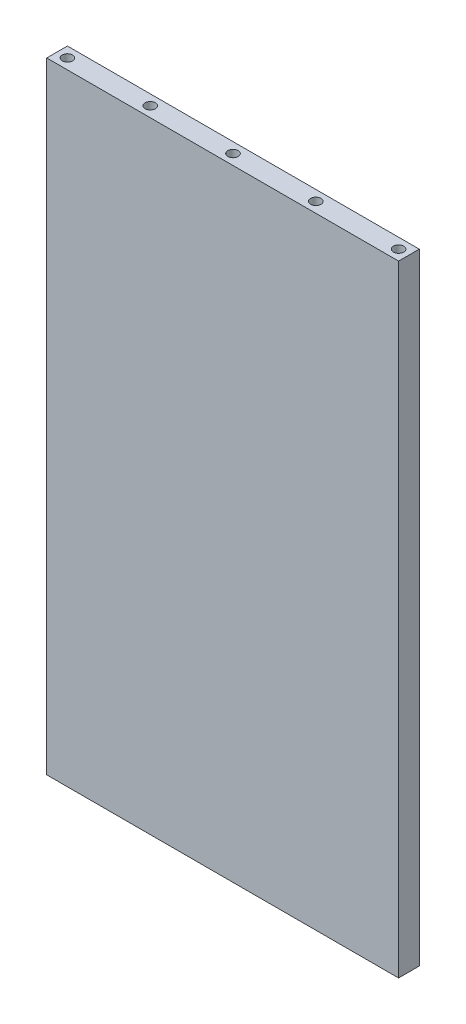
from build123d import *

# Parameters (mm, degrees)
CROQUIS1_W              = 170
CROQUIS1_H              = 300
SALIENTE_EXTRUIR1_DEPTH = 5
CROQUIS3_R              = 2.5
CORTAR_EXTRUIR2_DEPTH   = 5
CROQUIS4_R              = 2.5
CORTAR_EXTRUIR3_DEPTH   = 5


with BuildPart() as part:
    # Croquis1 → Saliente-Extruir1 (new, symmetric)
    with BuildSketch(Plane.XY):
        Rectangle(CROQUIS1_W, CROQUIS1_H)
    extrude(amount=SALIENTE_EXTRUIR1_DEPTH, both=True)

    # Croquis3 → Cortar-Extruir2 (cut)
    with BuildSketch(Plane.XZ.offset(150)):
        with Locations(Location((80, 0, 0), (0, 0, 270))):
            Circle(CROQUIS3_R)
        with Locations(Location((40, 0, 0), (0, 0, 270))):
            Circle(CROQUIS3_R)
        with Locations(Location((0, 0, 0), (0, 0, 270))):
            Circle(CROQUIS3_R)
        with Locations(Location((-40, 0, 0), (0, 0, 270))):
            Circle(CROQUIS3_R)
        with Locations(Location((-80, 0, 0), (0, 0, 270))):
            Circle(CROQUIS3_R)
    cortar_extruir2 = extrude(amount=-CORTAR_EXTRUIR2_DEPTH, mode=Mode.SUBTRACT)

    # Simetría1: Cortar-Extruir2 across plane
    add(cortar_extruir2.mirror(Plane.ZX), mode=Mode.SUBTRACT)

    # Croquis4 → Cortar-Extruir3 (cut)
    with BuildSketch(Plane.ZY.offset(85)):
        Circle(CROQUIS4_R)
        with Locations((0, 77.5)):
            Circle(CROQUIS4_R)
        with Locations(Location((0, -77.5, 0), (0, 0, 180))):
            Circle(CROQUIS4_R)
    extrude(amount=-CORTAR_EXTRUIR3_DEPTH, mode=Mode.SUBTRACT)


solid = part.part
